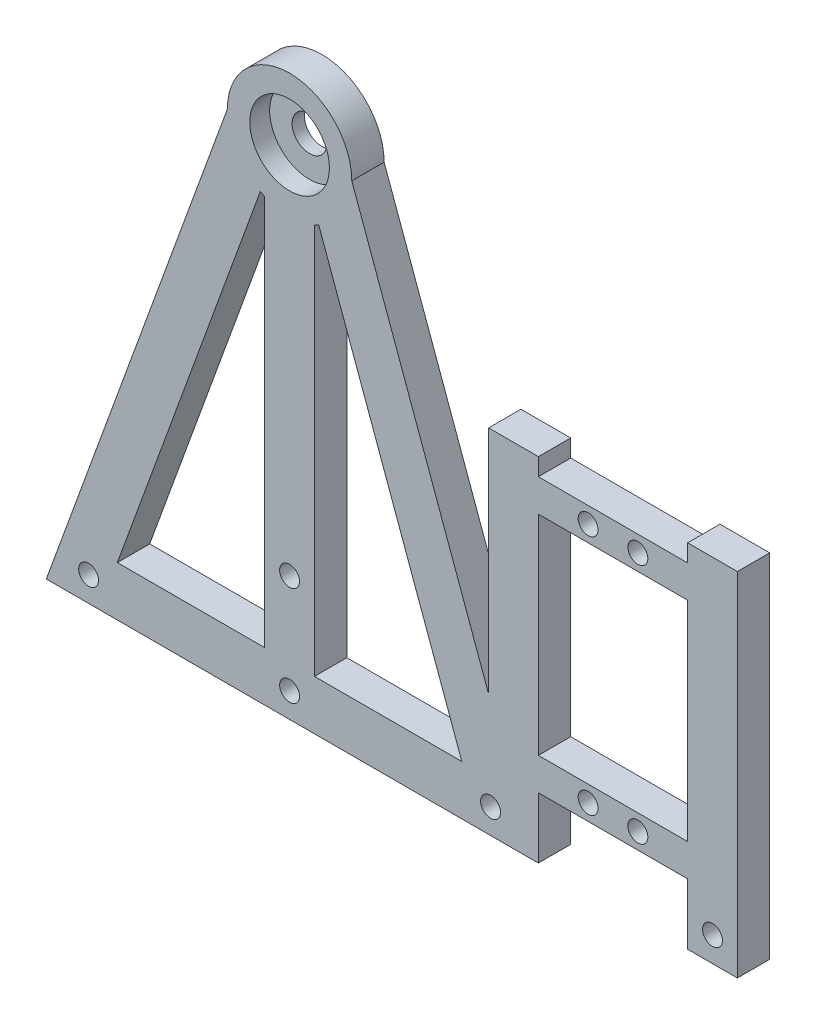
from build123d import *

# Parameters (mm, degrees)
SKETCH1_R           = 12.5
SKETCH1_W           = 10
SKETCH1_H           = 70.75
SKETCH1_W_2         = 30
SKETCH1_H_2         = 6.5
BOSS_EXTRUDE1_DEPTH = 6.5
CUT_EXTRUDE1_REACH  = 146.217
SKETCH2_R           = 3.5
SKETCH2_3_R         = 8
SKETCH2_3_R_2       = 3.5
CUT_EXTRUDE2_DEPTH  = 4
CUT_EXTRUDE4_REACH  = 146.217
SKETCH3_R           = 2
CUT_EXTRUDE6_REACH  = 146.217
SKETCH5_R           = 2


with BuildPart() as part:
    # Sketch1 → Boss-Extrude1 (new body)
    with BuildSketch(Plane.XY):
        with Locations((0, 100)):
            Circle(SKETCH1_R)
        with BuildLine():
            Line((-48.897023427, 0), (48.897023427, 0))
            Line((48.897023427, 0), (12.5, 100))
            ThreePointArc((12.5, 100), (10.716279715, 93.564834962), (5.87418415, 88.966235431))
            Line((5.87418415, 88.966235431), (34.615543359, 10))
            Line((34.615543359, 10), (-34.615543359, 10))
            Line((-34.615543359, 10), (-5.87418415, 88.966235431))
            ThreePointArc((-5.87418415, 88.966235431), (-10.716279715, 93.564834962), (-12.5, 100))
            Line((-12.5, 100), (-48.897023427, 0))
        make_face()
        with BuildLine():
            Line((-5, 10), (5, 10))
            Line((5, 10), (5, 88.543560763))
            ThreePointArc((5, 88.543560763), (0, 87.5), (-5, 88.543560763))
            Line((-5, 88.543560763), (-5, 10))
        make_face()
        with Locations((85, 35.375)):
            Rectangle(SKETCH1_W, SKETCH1_H)
        with Locations((65, 15.5)):
            Rectangle(SKETCH1_W_2, SKETCH1_H_2)
        with Locations((65, 64)):
            Rectangle(SKETCH1_W_2, SKETCH1_H_2)
        with Locations((45, 35.375)):
            Rectangle(SKETCH1_W, SKETCH1_H)
    extrude(amount=BOSS_EXTRUDE1_DEPTH)

    # Sketch2 → Cut-Extrude1 (cut, up to next)
    with BuildSketch(Plane.XY.offset(6.5), mode=Mode.PRIVATE) as cut_extrude1_sk1:
        with Locations((0, 100)):
            Circle(SKETCH2_R)
    cut_extrude1_tool1 = extrude(cut_extrude1_sk1.sketch, amount=-CUT_EXTRUDE1_REACH, mode=Mode.PRIVATE) & part.part
    add(cut_extrude1_tool1.solids().sort_by_distance((0, 100, 6.5))[0], mode=Mode.SUBTRACT)

    # Sketch2<3> → Cut-Extrude2 (cut)
    with BuildSketch(Plane.XY.offset(6.5)):
        with Locations((0, 100)):
            Circle(SKETCH2_3_R)
        with Locations((0, 100)):
            Circle(SKETCH2_3_R_2, mode=Mode.SUBTRACT)
    extrude(amount=-CUT_EXTRUDE2_DEPTH, mode=Mode.SUBTRACT)

    # Sketch3 → Cut-Extrude4 (cut, up to next)
    with BuildSketch(Plane.XY.offset(6.5), mode=Mode.PRIVATE) as cut_extrude4_sk1:
        with Locations((0, 5)):
            Circle(SKETCH3_R)
    cut_extrude4_tool1 = extrude(cut_extrude4_sk1.sketch, amount=-CUT_EXTRUDE4_REACH, mode=Mode.PRIVATE) & part.part
    # Sketch3 → Cut-Extrude4 (cut, up to next)
    with BuildSketch(Plane.XY.offset(6.5), mode=Mode.PRIVATE) as cut_extrude4_sk2:
        with Locations((40.397023427, 5)):
            Circle(SKETCH3_R)
    cut_extrude4_tool2 = extrude(cut_extrude4_sk2.sketch, amount=-CUT_EXTRUDE4_REACH, mode=Mode.PRIVATE) & part.part
    # Sketch3 → Cut-Extrude4 (cut, up to next)
    with BuildSketch(Plane.XY.offset(6.5), mode=Mode.PRIVATE) as cut_extrude4_sk3:
        with Locations((-40.397023427, 5)):
            Circle(SKETCH3_R)
    cut_extrude4_tool3 = extrude(cut_extrude4_sk3.sketch, amount=-CUT_EXTRUDE4_REACH, mode=Mode.PRIVATE) & part.part
    # Sketch3 → Cut-Extrude4 (cut, up to next)
    with BuildSketch(Plane.XY.offset(6.5), mode=Mode.PRIVATE) as cut_extrude4_sk4:
        with Locations((0, 25)):
            Circle(SKETCH3_R)
    cut_extrude4_tool4 = extrude(cut_extrude4_sk4.sketch, amount=-CUT_EXTRUDE4_REACH, mode=Mode.PRIVATE) & part.part
    # Sketch3 → Cut-Extrude4 (cut, up to next)
    with BuildSketch(Plane.XY.offset(6.5), mode=Mode.PRIVATE) as cut_extrude4_sk5:
        with Locations((85, 5)):
            Circle(SKETCH3_R)
    cut_extrude4_tool5 = extrude(cut_extrude4_sk5.sketch, amount=-CUT_EXTRUDE4_REACH, mode=Mode.PRIVATE) & part.part
    add(cut_extrude4_tool1.solids().sort_by_distance((0, 5, 6.5))[0], mode=Mode.SUBTRACT)
    add(cut_extrude4_tool2.solids().sort_by_distance((40.397023, 5, 6.5))[0], mode=Mode.SUBTRACT)
    add(cut_extrude4_tool3.solids().sort_by_distance((-40.397023, 5, 6.5))[0], mode=Mode.SUBTRACT)
    add(cut_extrude4_tool4.solids().sort_by_distance((0, 25, 6.5))[0], mode=Mode.SUBTRACT)
    add(cut_extrude4_tool5.solids().sort_by_distance((85, 5, 6.5))[0], mode=Mode.SUBTRACT)

    # Sketch5 → Cut-Extrude6 (cut, up to next)
    with BuildSketch(Plane.XY.offset(6.5), mode=Mode.PRIVATE) as cut_extrude6_sk1:
        with Locations((60, 64)):
            Circle(SKETCH5_R)
    cut_extrude6_tool1 = extrude(cut_extrude6_sk1.sketch, amount=-CUT_EXTRUDE6_REACH, mode=Mode.PRIVATE) & part.part
    # Sketch5 → Cut-Extrude6 (cut, up to next)
    with BuildSketch(Plane.XY.offset(6.5), mode=Mode.PRIVATE) as cut_extrude6_sk2:
        with Locations((70, 64)):
            Circle(SKETCH5_R)
    cut_extrude6_tool2 = extrude(cut_extrude6_sk2.sketch, amount=-CUT_EXTRUDE6_REACH, mode=Mode.PRIVATE) & part.part
    # Sketch5 → Cut-Extrude6 (cut, up to next)
    with BuildSketch(Plane.XY.offset(6.5), mode=Mode.PRIVATE) as cut_extrude6_sk3:
        with Locations((70, 15.5)):
            Circle(SKETCH5_R)
    cut_extrude6_tool3 = extrude(cut_extrude6_sk3.sketch, amount=-CUT_EXTRUDE6_REACH, mode=Mode.PRIVATE) & part.part
    # Sketch5 → Cut-Extrude6 (cut, up to next)
    with BuildSketch(Plane.XY.offset(6.5), mode=Mode.PRIVATE) as cut_extrude6_sk4:
        with Locations((60, 15.5)):
            Circle(SKETCH5_R)
    cut_extrude6_tool4 = extrude(cut_extrude6_sk4.sketch, amount=-CUT_EXTRUDE6_REACH, mode=Mode.PRIVATE) & part.part
    add(cut_extrude6_tool1.solids().sort_by_distance((60, 64, 6.5))[0], mode=Mode.SUBTRACT)
    add(cut_extrude6_tool2.solids().sort_by_distance((70, 64, 6.5))[0], mode=Mode.SUBTRACT)
    add(cut_extrude6_tool3.solids().sort_by_distance((70, 15.5, 6.5))[0], mode=Mode.SUBTRACT)
    add(cut_extrude6_tool4.solids().sort_by_distance((60, 15.5, 6.5))[0], mode=Mode.SUBTRACT)


solid = part.part
